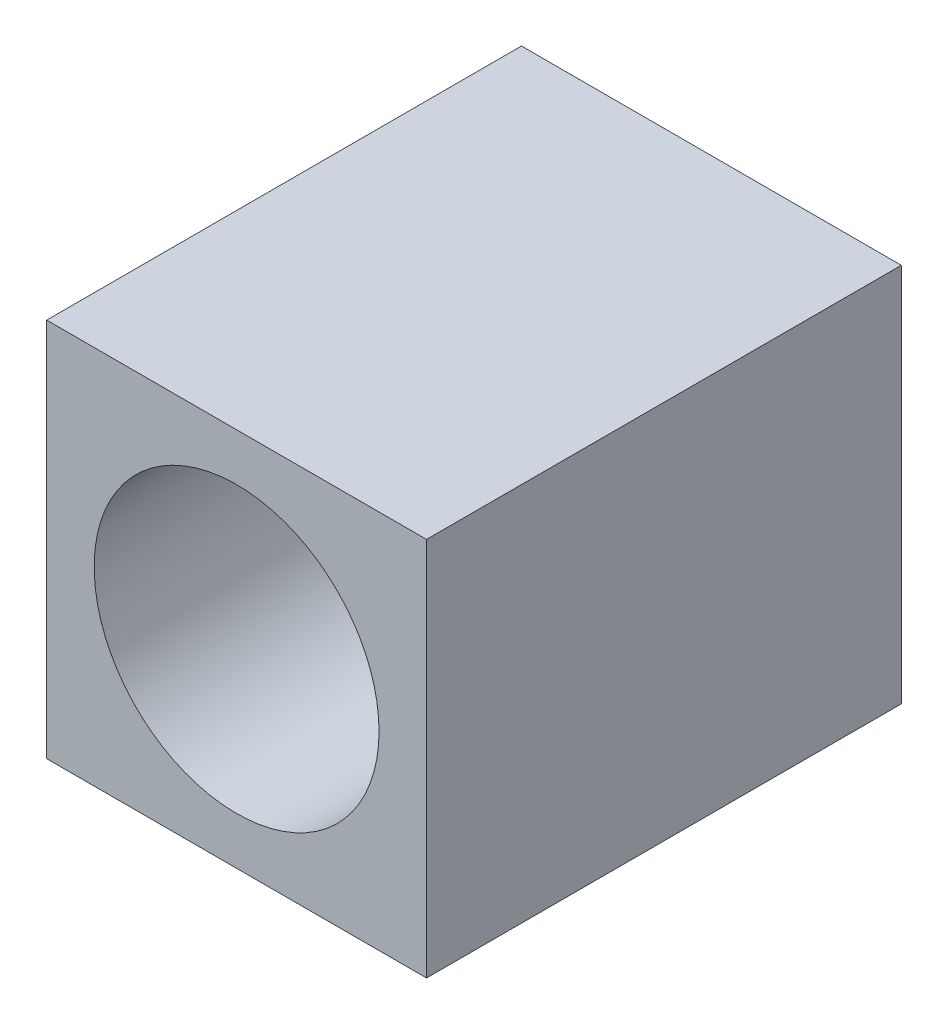
from build123d import *

# Parameters (mm, degrees)
SKETCH2_W           = 40
SKETCH2_H           = 40
SKETCH2_R           = 15
BOSS_EXTRUDE1_DEPTH = 50


with BuildPart() as part:
    # Sketch2 → Boss-Extrude1 (new body)
    with BuildSketch(Plane.XY):
        Rectangle(SKETCH2_W, SKETCH2_H)
        Circle(SKETCH2_R, mode=Mode.SUBTRACT)
    extrude(amount=BOSS_EXTRUDE1_DEPTH)


solid = part.part
